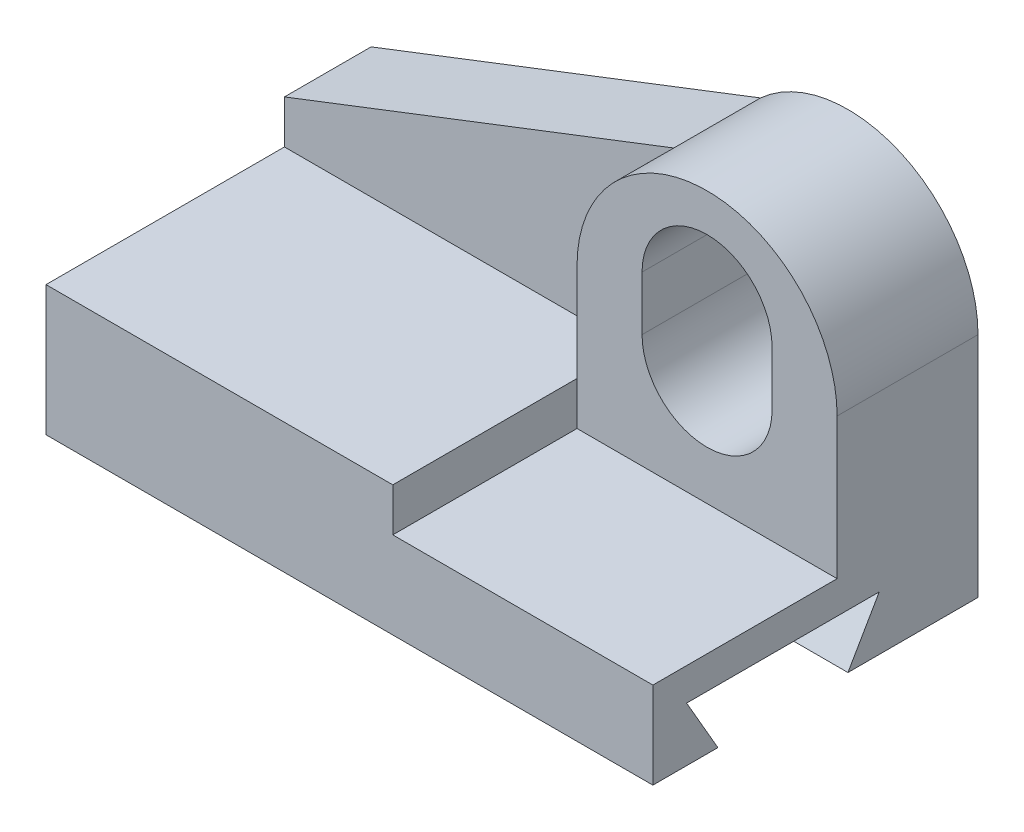
from build123d import *

# Parameters (mm, degrees)
SKETCH_1_W          = 56
SKETCH_1_H          = 30
EXTRUDE_1_DEPTH     = 8
SKETCH_2_W          = 32
SKETCH_2_H          = 22
EXTRUDE_2_DEPTH     = 4
CUT_EXTRUDE_1_DEPTH = 60.203040462
SKETCH_4_W          = 32
SKETCH_4_H          = 8
EXTRUDE_3_DEPTH     = 8
EXTRUDE_8_DEPTH     = 13
CUT_EXTRUDE_2_DEPTH = 53.659282183
RIB_1_REACH         = 52.488
SKETCH_13_WALL_W    = 150.145150152
SKETCH_13_WALL_H    = 8


with BuildPart() as part:
    # 草图1 → 凸台-拉伸1 (new body)
    with BuildSketch(Plane(origin=(0, 0, 0), x_dir=(1, 0, 0), z_dir=(0, 1, 0))):
        Rectangle(SKETCH_1_W, SKETCH_1_H)
    extrude(amount=EXTRUDE_1_DEPTH)

    # 草图2 → 凸台-拉伸2 (add)
    with BuildSketch(Plane(origin=(0, 8, 0), x_dir=(1, 0, 0), z_dir=(0, 1, 0))):
        with Locations((-12, -4)):
            Rectangle(SKETCH_2_W, SKETCH_2_H)
    extrude(amount=EXTRUDE_2_DEPTH)

    # 草图3 → 切除-拉伸1 (cut, through all)
    with BuildSketch(Plane.ZY.offset(28)):
        Polygon((9, 0), (11.886751346, 5), (-5.886751346, 5), (-3, 0), align=None)
    extrude(amount=-CUT_EXTRUDE_1_DEPTH, mode=Mode.SUBTRACT)

    # 草图4 → 凸台-拉伸3 (add)
    with BuildSketch(Plane(origin=(0, 8, 0), x_dir=(1, 0, 0), z_dir=(0, 1, 0))):
        with Locations((-12, 11)):
            Rectangle(SKETCH_4_W, SKETCH_4_H)
    extrude(amount=EXTRUDE_3_DEPTH)

    # 草图7 → 凸台-拉伸8 (add)
    with BuildSketch(Plane(origin=(0, 0, -15), x_dir=(-1, 0, 0), z_dir=(0, 0, -1))):
        with BuildLine():
            Line((-28, 8), (-28, 21))
            ThreePointArc((-28, 21), (-16, 33), (-4, 21))
            Line((-4, 21), (-4, 8))
            Line((-4, 8), (-28, 8))
        make_face()
    extrude(amount=-EXTRUDE_8_DEPTH)

    # 草图8 → 切除-拉伸2 (cut, through all)
    with BuildSketch(Plane(origin=(0, 0, -15), x_dir=(-1, 0, 0), z_dir=(0, 0, -1))):
        with BuildLine():
            Line((-22, 18.5), (-22, 23.5))
            ThreePointArc((-22, 23.5), (-16, 29.5), (-10, 23.5))
            Line((-10, 23.5), (-10, 18.5))
            ThreePointArc((-10, 18.5), (-16, 12.5), (-22, 18.5))
        make_face()
    extrude(amount=-CUT_EXTRUDE_2_DEPTH, mode=Mode.SUBTRACT)

    # 草图13 wall → 筋1 (add, up to next)
    with BuildSketch(Plane(origin=(-6, 24.5, -11), x_dir=(0.932798134406, 0.360399279202, 0), z_dir=(-0.360399279202, 0.932798134406, 0)), mode=Mode.PRIVATE) as rib_1_sk1:
        Rectangle(SKETCH_13_WALL_W, SKETCH_13_WALL_H)
    rib_1_tool1 = extrude(rib_1_sk1.sketch, amount=-RIB_1_REACH, mode=Mode.PRIVATE) - part.part
    add(rib_1_tool1.solids().sort_by_distance((-6, 24.5, -11))[0])


solid = part.part
